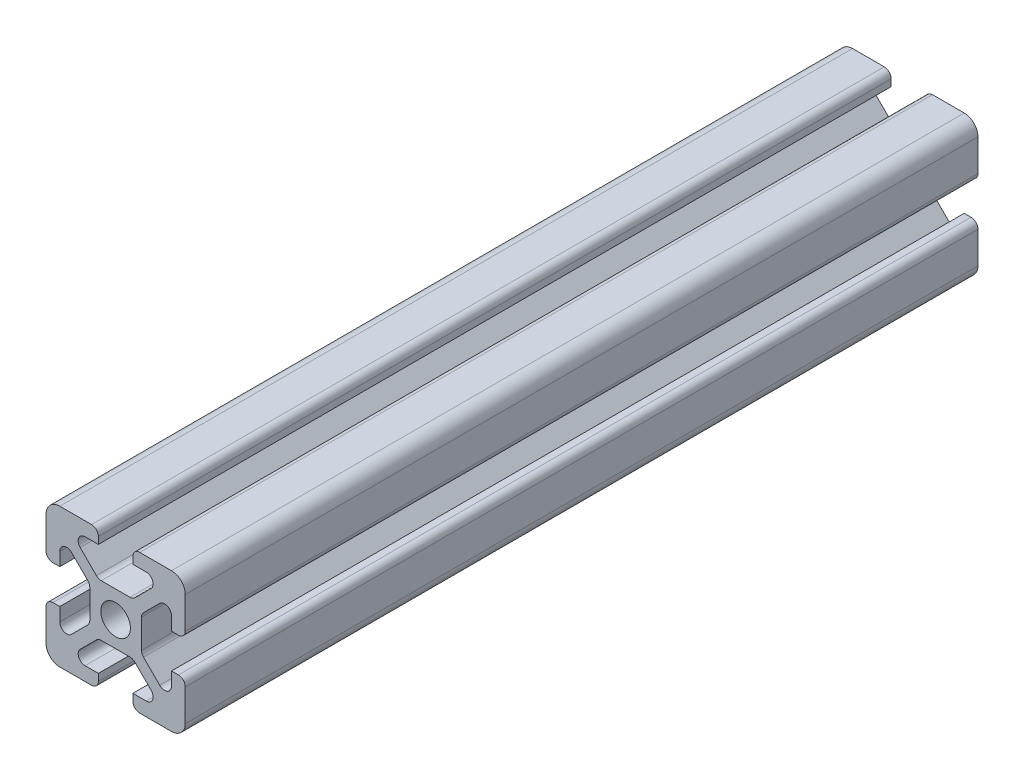
from build123d import *

# Parameters (mm, degrees)
SKETCH1_R           = 2.15
BOSS_EXTRUDE1_DEPTH = 115


with BuildPart() as part:
    # Sketch1 → Boss-Extrude1 (new body)
    with BuildSketch(Plane.XY):
        with BuildLine():
            Line((2, 0), (6.6, 0))
            ThreePointArc((6.6, 0), (7.307106781, 0.292893219), (7.6, 1))
            Line((7.6, 1), (7.6, 2))
            Line((7.6, 2), (5.664213562, 2))
            ThreePointArc((5.664213562, 2), (4.74033403, 2.617316568), (4.957106781, 3.707106781))
            Line((4.957106781, 3.707106781), (7.307106781, 6.057106781))
            ThreePointArc((7.307106781, 6.057106781), (7.63153013, 6.273879533), (8.014213562, 6.35))
            Line((8.014213562, 6.35), (12.185786438, 6.35))
            ThreePointArc((12.185786438, 6.35), (12.56846987, 6.273879533), (12.892893219, 6.057106781))
            Line((12.892893219, 6.057106781), (15.242893219, 3.707106781))
            ThreePointArc((15.242893219, 3.707106781), (15.45966597, 2.617316568), (14.535786438, 2))
            Line((14.535786438, 2), (12.6, 2))
            Line((12.6, 2), (12.6, 1))
            ThreePointArc((12.6, 1), (12.892893219, 0.292893219), (13.6, 0))
            Line((13.6, 0), (18.2, 0))
            ThreePointArc((18.2, 0), (19.614213562, 0.585786438), (20.2, 2))
            Line((20.2, 2), (20.2, 6.6))
            ThreePointArc((20.2, 6.6), (19.907106781, 7.307106781), (19.2, 7.6))
            Line((19.2, 7.6), (18.2, 7.6))
            Line((18.2, 7.6), (18.2, 5.664213562))
            ThreePointArc((18.2, 5.664213562), (17.582683432, 4.74033403), (16.492893219, 4.957106781))
            Line((16.492893219, 4.957106781), (14.142893219, 7.307106781))
            ThreePointArc((14.142893219, 7.307106781), (13.926120467, 7.63153013), (13.85, 8.014213562))
            Line((13.85, 8.014213562), (13.85, 12.185786438))
            ThreePointArc((13.85, 12.185786438), (13.926120467, 12.56846987), (14.142893219, 12.892893219))
            Line((14.142893219, 12.892893219), (16.492893219, 15.242893219))
            ThreePointArc((16.492893219, 15.242893219), (17.582683432, 15.45966597), (18.2, 14.535786438))
            Line((18.2, 14.535786438), (18.2, 12.6))
            Line((18.2, 12.6), (19.2, 12.6))
            ThreePointArc((19.2, 12.6), (19.907106781, 12.892893219), (20.2, 13.6))
            Line((20.2, 13.6), (20.2, 18.2))
            ThreePointArc((20.2, 18.2), (19.614213562, 19.614213562), (18.2, 20.2))
            Line((18.2, 20.2), (13.6, 20.2))
            ThreePointArc((13.6, 20.2), (12.892893219, 19.907106781), (12.6, 19.2))
            Line((12.6, 19.2), (12.6, 18.2))
            Line((12.6, 18.2), (14.535786438, 18.2))
            ThreePointArc((14.535786438, 18.2), (15.45966597, 17.582683432), (15.242893219, 16.492893219))
            Line((15.242893219, 16.492893219), (12.892893219, 14.142893219))
            ThreePointArc((12.892893219, 14.142893219), (12.56846987, 13.926120467), (12.185786438, 13.85))
            Line((12.185786438, 13.85), (8.014213562, 13.85))
            ThreePointArc((8.014213562, 13.85), (7.63153013, 13.926120467), (7.307106781, 14.142893219))
            Line((7.307106781, 14.142893219), (4.957106781, 16.492893219))
            ThreePointArc((4.957106781, 16.492893219), (4.74033403, 17.582683432), (5.664213562, 18.2))
            Line((5.664213562, 18.2), (7.6, 18.2))
            Line((7.6, 18.2), (7.6, 19.2))
            ThreePointArc((7.6, 19.2), (7.307106781, 19.907106781), (6.6, 20.2))
            Line((6.6, 20.2), (2, 20.2))
            ThreePointArc((2, 20.2), (0.585786438, 19.614213562), (0, 18.2))
            Line((0, 18.2), (0, 13.6))
            ThreePointArc((0, 13.6), (0.292893219, 12.892893219), (1, 12.6))
            Line((1, 12.6), (2, 12.6))
            Line((2, 12.6), (2, 14.535786438))
            ThreePointArc((2, 14.535786438), (2.617316568, 15.45966597), (3.707106781, 15.242893219))
            Line((3.707106781, 15.242893219), (6.057106781, 12.892893219))
            ThreePointArc((6.057106781, 12.892893219), (6.273879533, 12.56846987), (6.35, 12.185786438))
            Line((6.35, 12.185786438), (6.35, 8.014213562))
            ThreePointArc((6.35, 8.014213562), (6.273879533, 7.63153013), (6.057106781, 7.307106781))
            Line((6.057106781, 7.307106781), (3.707106781, 4.957106781))
            ThreePointArc((3.707106781, 4.957106781), (2.617316568, 4.74033403), (2, 5.664213562))
            Line((2, 5.664213562), (2, 7.6))
            Line((2, 7.6), (1, 7.6))
            ThreePointArc((1, 7.6), (0.292893219, 7.307106781), (0, 6.6))
            Line((0, 6.6), (0, 2))
            ThreePointArc((0, 2), (0.585786438, 0.585786438), (2, 0))
        make_face()
        with Locations((10.1, 10)):
            Circle(SKETCH1_R, mode=Mode.SUBTRACT)
    extrude(amount=BOSS_EXTRUDE1_DEPTH)


solid = part.part
